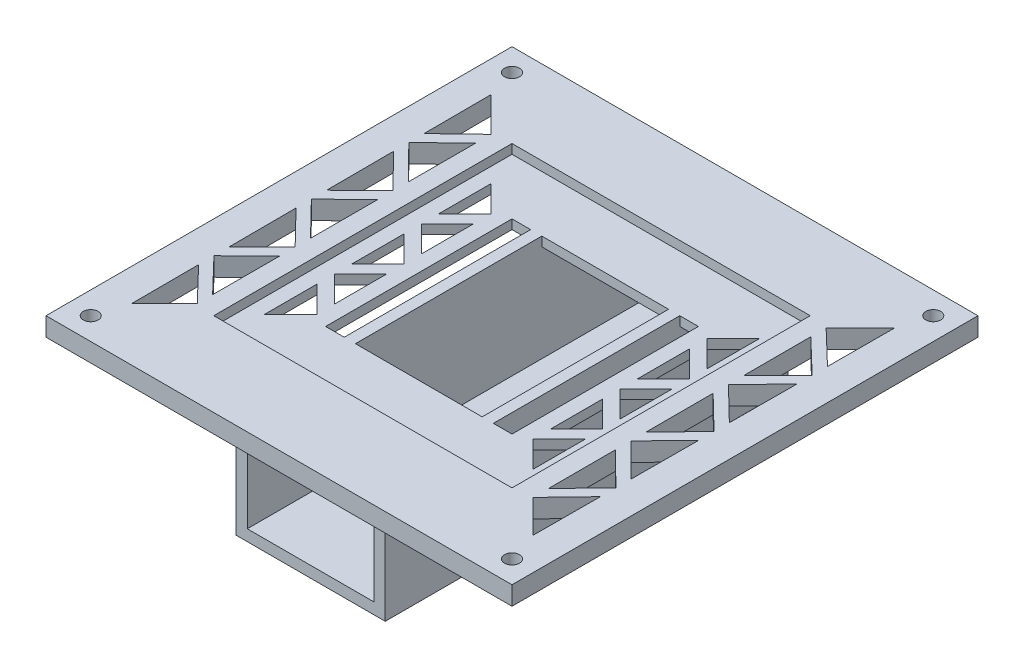
from build123d import *

# Parameters (mm, degrees)
SKETCH_2_W               = 125
SKETCH_2_H               = 125
SKETCH_2_R               = 2
SKETCH_2_W_2             = 50
SKETCH_2_H_2             = 50
EXTRUDE_1_DEPTH          = 2.5
EXTRUDE_4_DEPTH          = 54
SKETCH_7_W               = 80
SKETCH_7_H               = 80
CUT_EXTRUDE_1_DEPTH      = 10
CUT_EXTRUDE_2_DEPTH      = 95.702164706
CUT_EXTRUDE_2_DEPTH_BACK = 5


with BuildPart() as part:
    # 스케치2 → 보스-돌출1 (new, symmetric)
    with BuildSketch(Plane(origin=(0, 0, 0), x_dir=(1, 0, 0), z_dir=(0, 1, 0))):
        Rectangle(SKETCH_2_W, SKETCH_2_H)
        with Locations((-56.5, 56.5)):
            Circle(SKETCH_2_R, mode=Mode.SUBTRACT)
        with Locations((56.5, 56.5)):
            Circle(SKETCH_2_R, mode=Mode.SUBTRACT)
        with Locations((-56.5, -56.5)):
            Circle(SKETCH_2_R, mode=Mode.SUBTRACT)
        with Locations((56.5, -56.5)):
            Circle(SKETCH_2_R, mode=Mode.SUBTRACT)
        Rectangle(SKETCH_2_W_2, SKETCH_2_H_2, mode=Mode.SUBTRACT)
    extrude(amount=EXTRUDE_1_DEPTH, both=True)

    # 스케치6 → 보스-돌출4 (add, symmetric)
    with BuildSketch(Plane.XY):
        Polygon((-20, 0), (-20, -31.5), (20, -31.5), (20, 0), (17, 0), (17, -28.5), (-17, -28.5), (-17, 0), align=None)
    extrude(amount=EXTRUDE_4_DEPTH, both=True)

    # 스케치7 → 컷-돌출1 (cut)
    with BuildSketch(Plane(origin=(0, 0, 0), x_dir=(1, 0, 0), z_dir=(0, 1, 0))):
        Rectangle(SKETCH_7_W, SKETCH_7_H)
    extrude(amount=CUT_EXTRUDE_1_DEPTH, mode=Mode.SUBTRACT)

    # 스케치8 → 컷-돌출2 (cut, two sides: drawn at the far end of the back side and taken through both)
    with BuildSketch(Plane(origin=(0, 2.5, 0), x_dir=(1, 0, 0), z_dir=(0, 1, 0)).offset(-CUT_EXTRUDE_2_DEPTH_BACK)):
        Polygon((54.07931581, 22.285580831), (54.015526938, 4.28569386), (44.986382589, 13.073341514), align=None)
        Polygon((36, -30.343145751), (36, -16.343145751), (29, -23.343145751), align=None)
        Polygon((29, 18.671572875), (29, 4.671572875), (36, 11.671572875), align=None)
        Polygon((36, 30.343145751), (29, 23.343145751), (36, 16.343145751), align=None)
        Polygon((53.829622097, -48.172767848), (45.041121619, -39.384267369), (53.893419828, -30.170381277), align=None)
        Polygon((45.036831341, -35.272800588), (45.018048518, -17.272810388), (53.90806007, -26.039210725), align=None)
        Polygon((44.95901306, 39.30215881), (54.172270373, 48.515416123), (54.1084815, 30.515529152), align=None)
        Polygon((53.922585518, -21.940432956), (45.013752114, -13.155472476), (53.986361248, -3.944254461), align=None)
        Polygon((45.009460593, -9.042814869), (54.001004771, 0.18784173), (44.99067777, 8.957175331), align=None)
        Polygon((44.982089846, 17.187170851), (54.093962598, 26.418598199), (44.963307022, 35.187161051), align=None)
        Polygon((29, 0), (36, 7), (36, -7), align=None)
        Polygon((36, -11.671572875), (29, -4.671572875), (29, -18.671572875), align=None)
        Polygon((-36, -7), (-36, 7), (-29, 0), align=None)
        Polygon((-29, -4.671572875), (-29, -18.671572875), (-36, -11.671572875), align=None)
        Polygon((-36, 16.343145751), (-36, 30.343145751), (-29, 23.343145751), align=None)
        Polygon((-36, -16.343145751), (-29, -23.343145751), (-36, -30.343145751), align=None)
        Polygon((-36, 11.671572875), (-29, 4.671572875), (-29, 18.671572875), align=None)
        Polygon((-53.893419828, -30.170381277), (-53.829622097, -48.172767848), (-45.041121619, -39.384267369), align=None)
        Polygon((-45.009460593, -9.042814869), (-44.99067777, 8.957175331), (-54.001004771, 0.18784173), align=None)
        Polygon((-53.986361248, -3.944254461), (-53.922585518, -21.940432956), (-45.013752114, -13.155472476), align=None)
        Polygon((-44.982089846, 17.187170851), (-44.963307022, 35.187161051), (-54.093962598, 26.418598199), align=None)
        Polygon((-54.1084815, 30.515529152), (-44.95901306, 39.30215881), (-54.172270373, 48.515416123), align=None)
        Polygon((-44.986382589, 13.073341514), (-54.07931581, 22.285580831), (-54.015526938, 4.28569386), align=None)
        Polygon((-53.90806007, -26.039210725), (-45.018048518, -17.272810388), (-45.036831341, -35.272800588), align=None)
    extrude(amount=CUT_EXTRUDE_2_DEPTH + CUT_EXTRUDE_2_DEPTH_BACK, mode=Mode.SUBTRACT)


solid = part.part
